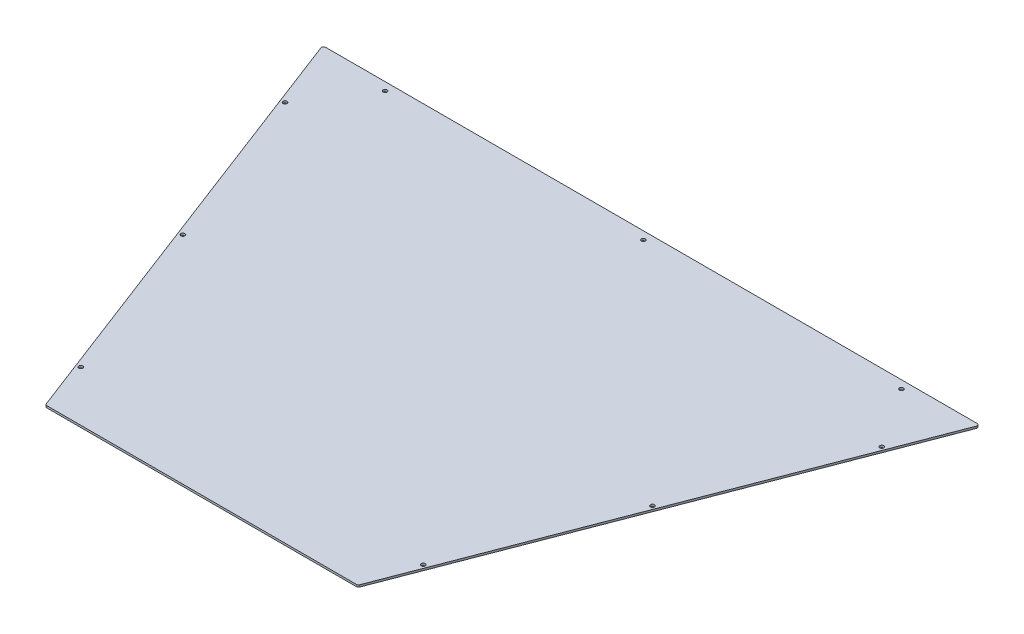
from build123d import *

# Parameters (mm, degrees)
BOSS_EXTRUDE1_DEPTH         = 3.175
FILLET1_R                   = 3.175
F_1_4_0_25_DIAMETER_HOLE1_D = 6.35


with BuildPart() as part:
    # Sketch1 → Boss-Extrude1 (new body)
    with BuildSketch(Plane(origin=(0, 0, 0), x_dir=(1, 0, 0), z_dir=(0, 1, 0))):
        Polygon((-245.911961207, 0), (245.911961207, 0), (517.525, 708.025), (-517.525, 708.025), align=None)
    extrude(amount=BOSS_EXTRUDE1_DEPTH)

    # Fillet1
    fillet1_edges = [part.edges().sort_by_distance(p)[0] for p in [
        (-517.525, 1.5875, -708.025),
        (517.525, 1.5875, -708.025),
        (245.911961207, 1.5875, 0),
        (-245.911961207, 1.5875, 0),
    ]]
    fillet(fillet1_edges, radius=FILLET1_R)

    # 1/4 (0.25) Diameter Hole1 (through all)
    with Locations(Plane(origin=(0, 3.175, 0), x_dir=(1, 0, 0), z_dir=(0, 1, 0))):
        with Locations((-406.4, 695.325), (0, 695.325), (406.4, 695.325), (-469.681706805, 601.038913991), (-369.60903133, 340.175310506), (-269.536355855, 79.311707021), (269.536355855, 79.311707021), (369.60903133, 340.175310506), (469.681706805, 601.038913991)):
            Hole(F_1_4_0_25_DIAMETER_HOLE1_D / 2)


solid = part.part
